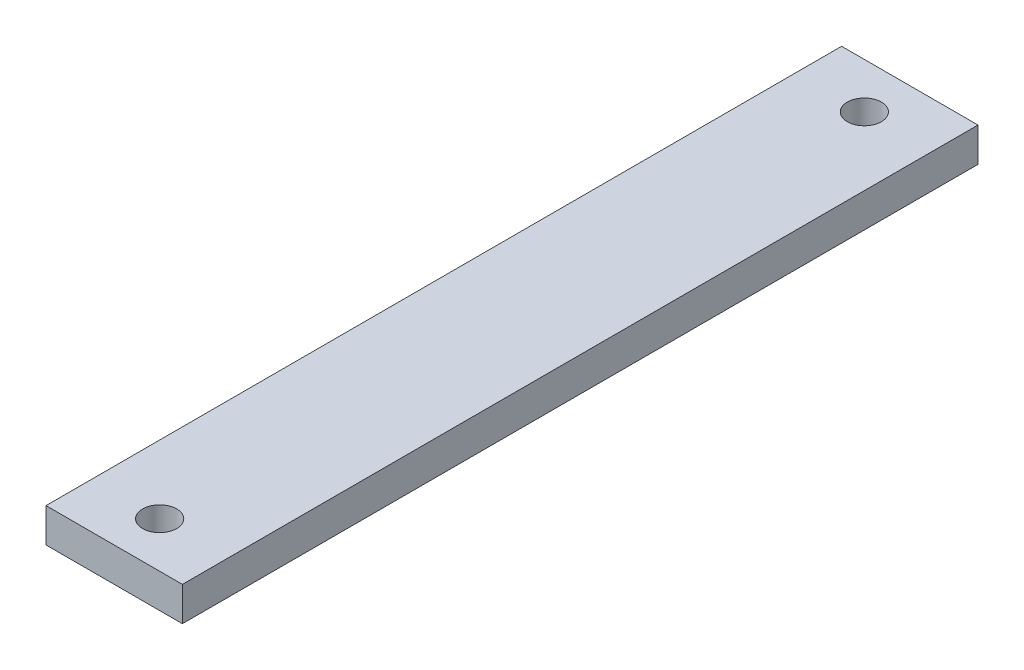
from build123d import *

# Parameters (mm, degrees)
SKETCH_1_W          = 12
SKETCH_1_H          = 70
EXTRUDE_1_DEPTH     = 3
SKETCH_2_R          = 1.5
CUT_EXTRUDE_1_DEPTH = 72.08445681


with BuildPart() as part:
    # 草图1 → 凸台-拉伸1 (new body)
    with BuildSketch(Plane(origin=(0, 0, 0), x_dir=(1, 0, 0), z_dir=(0, 1, 0))):
        with Locations((6, 35)):
            Rectangle(SKETCH_1_W, SKETCH_1_H)
    extrude(amount=EXTRUDE_1_DEPTH)

    # 草图2 → 切除-拉伸1 (cut, through all)
    with BuildSketch(Plane(origin=(0, 3, 0), x_dir=(1, 0, 0), z_dir=(0, 1, 0))):
        with Locations(Location((6, 4, 0), (0, 0, 270))):
            Circle(SKETCH_2_R)
        with Locations(Location((6, 66, 0), (0, 0, 270))):
            Circle(SKETCH_2_R)
    extrude(amount=-CUT_EXTRUDE_1_DEPTH, mode=Mode.SUBTRACT)


solid = part.part
